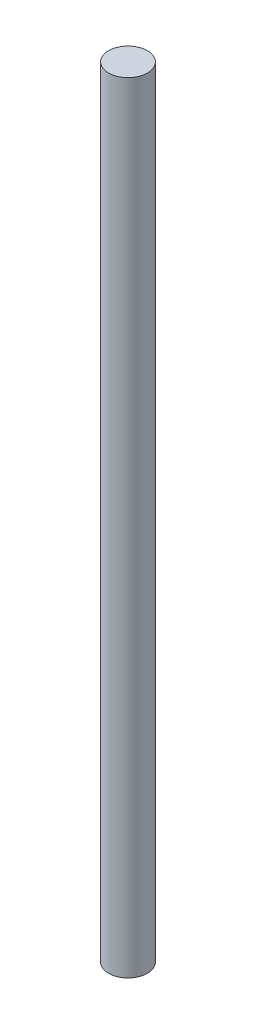
from build123d import *

# Parameters (mm, degrees)
SKETCH1_R           = 4.975
BOSS_EXTRUDE1_DEPTH = 200


with BuildPart() as part:
    # Sketch1 → Boss-Extrude1 (new body)
    with BuildSketch(Plane(origin=(0, 0, 0), x_dir=(1, 0, 0), z_dir=(0, 1, 0))):
        with Locations(Location((0, 0, 0), (0, 0, 270))):
            Circle(SKETCH1_R)
    extrude(amount=-BOSS_EXTRUDE1_DEPTH)


solid = part.part
